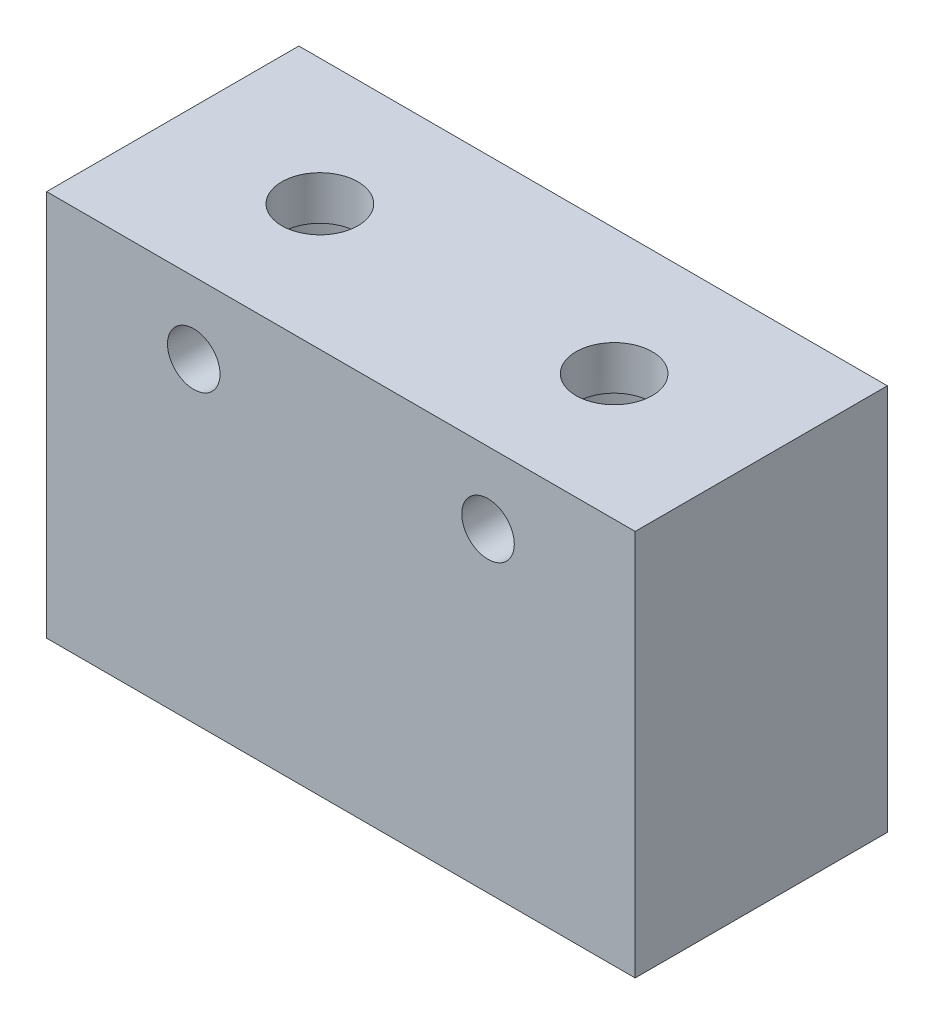
from build123d import *

# Parameters (mm, degrees)
SKETCH1_W                  = 88.9
SKETCH1_H                  = 38.1
BLOCK_DEPTH                = 58.42
SPRING_BORES_D             = 25.4
SPRING_BORES_DEPTH         = 47.625
SPRING_BORES_TIP           = 7.630929862
F_1_2_20_TAPPED_HOLES_D    = 11.50874
VIEW_HOLES_D               = 7.9375
F_10_32_TAPPED_HOLES_D     = 4.0386
F_10_32_TAPPED_HOLES_DEPTH = 19.05
F_10_32_TAPPED_HOLES_TIP   = 1.213317848


with BuildPart() as part:
    # Sketch1 → Block (new body)
    with BuildSketch(Plane(origin=(0, 0, 0), x_dir=(1, 0, 0), z_dir=(0, 1, 0))):
        Rectangle(SKETCH1_W, SKETCH1_H)
    extrude(amount=BLOCK_DEPTH)

    # Spring Bores
    with Locations(Plane(origin=(0, 0, 0), x_dir=(-1, 0, 0), z_dir=(0, -1, 0))):
        with Locations((22.225, 0), (-22.225, 0)):
            Hole(SPRING_BORES_D / 2, depth=SPRING_BORES_DEPTH)
            with Locations((0, 0, -(SPRING_BORES_DEPTH + SPRING_BORES_TIP / 2))):  # 118° drill point
                Cone(0, SPRING_BORES_D / 2, SPRING_BORES_TIP, mode=Mode.SUBTRACT)

    # 1/2-20 Tapped Holes (through all)
    with Locations(Plane(origin=(0, 58.42, 0), x_dir=(1, 0, 0), z_dir=(0, 1, 0))):
        with Locations((-22.225, 0), (22.225, 0)):
            Hole(F_1_2_20_TAPPED_HOLES_D / 2)

    # View Holes (through all)
    with Locations(Plane.XY.offset(19.05)):
        with Locations((-22.225, 47.625), (22.225, 47.625)):
            Hole(VIEW_HOLES_D / 2)

    # #10-32 Tapped Holes
    with Locations(Plane(origin=(0, 0, 0), x_dir=(-1, 0, 0), z_dir=(0, -1, 0))):
        with Locations((0, -11.1125), (0, 11.1125), (36.5125, -11.1125), (36.5125, 11.1125), (-36.5125, 11.1125), (-36.5125, -11.1125)):
            Hole(F_10_32_TAPPED_HOLES_D / 2, depth=F_10_32_TAPPED_HOLES_DEPTH)
            with Locations((0, 0, -(F_10_32_TAPPED_HOLES_DEPTH + F_10_32_TAPPED_HOLES_TIP / 2))):  # 118° drill point
                Cone(0, F_10_32_TAPPED_HOLES_D / 2, F_10_32_TAPPED_HOLES_TIP, mode=Mode.SUBTRACT)


solid = part.part
